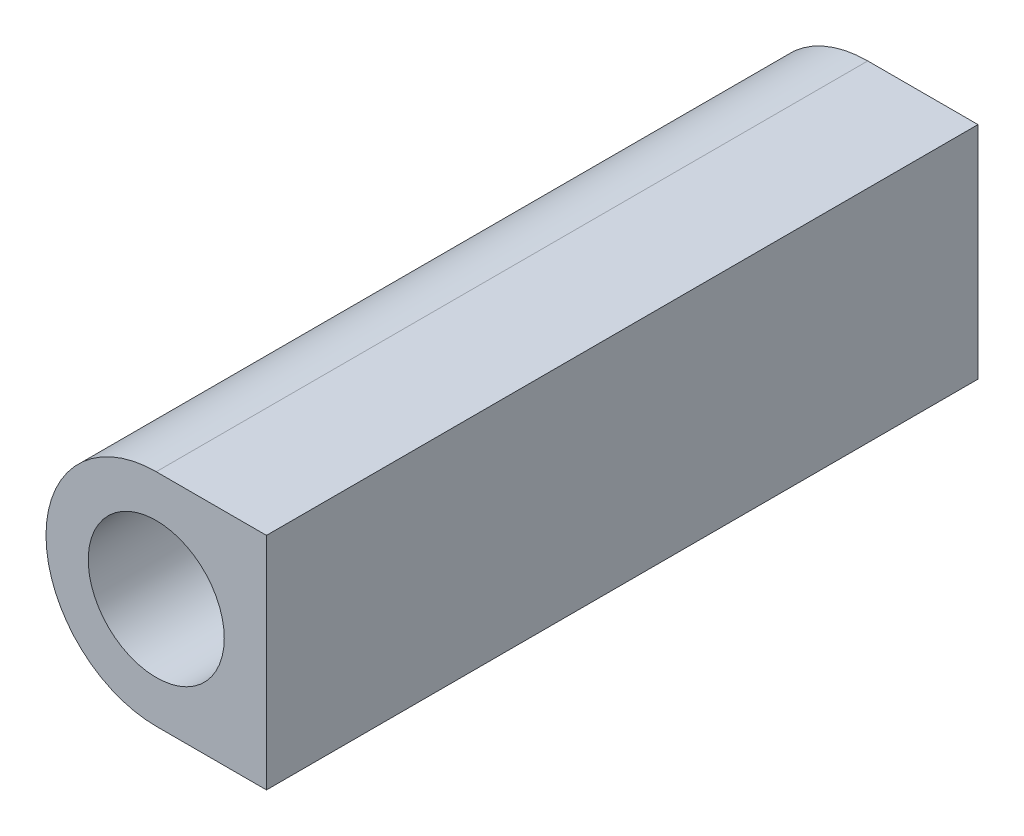
from build123d import *

# Parameters (mm, degrees)
BOSS_EXTRUDE5_DEPTH = 80.682375276
SKETCH6_R           = 7.713097058
CUT_EXTRUDE3_DEPTH  = 25
SKETCH7_R           = 3.5
CUT_EXTRUDE4_DEPTH  = 5
SKETCH8_R           = 7.713097058
CUT_EXTRUDE5_DEPTH  = 50
SKETCH9_R           = 3.5
CUT_EXTRUDE6_DEPTH  = 50


with BuildPart() as part:
    # Sketch3 → Boss-Extrude5 (new body)
    with BuildSketch(Plane(origin=(0, 0, 0), x_dir=(0, 1, 0), z_dir=(0, 0, 1))):
        with BuildLine():
            Line((-12.5, 0), (-12.5, -12.5))
            Line((-12.5, -12.5), (12.5, -12.5))
            Line((12.5, -12.5), (12.5, 0))
            ThreePointArc((12.5, 0), (0, 12.5), (-12.5, 0))
        make_face()
    extrude(amount=BOSS_EXTRUDE5_DEPTH)

    # Sketch6 → Cut-Extrude3 (cut)
    with BuildSketch(Plane.XY.offset(80.682375276)):
        Circle(SKETCH6_R)
    extrude(amount=-CUT_EXTRUDE3_DEPTH, mode=Mode.SUBTRACT)

    # Sketch7 → Cut-Extrude4 (cut)
    with BuildSketch(Plane(origin=(0, 0, 0), x_dir=(1, 0, 0), z_dir=(0, 0, -1))):
        with Locations(Location((0, 0, 0), (0, 0, 180))):
            Circle(SKETCH7_R)
    extrude(amount=-CUT_EXTRUDE4_DEPTH, mode=Mode.SUBTRACT)

    # Sketch8 → Cut-Extrude5 (cut)
    with BuildSketch(Plane.XY.offset(55.682375276)):
        Circle(SKETCH8_R)
    extrude(amount=-CUT_EXTRUDE5_DEPTH, mode=Mode.SUBTRACT)

    # Sketch9 → Cut-Extrude6 (cut)
    with BuildSketch(Plane(origin=(0, 0, 0), x_dir=(1, 0, 0), z_dir=(0, 0, -1))):
        with Locations(Location((0, 0, 0), (0, 0, 180))):
            Circle(SKETCH9_R)
    extrude(amount=-CUT_EXTRUDE6_DEPTH, mode=Mode.SUBTRACT)


solid = part.part
